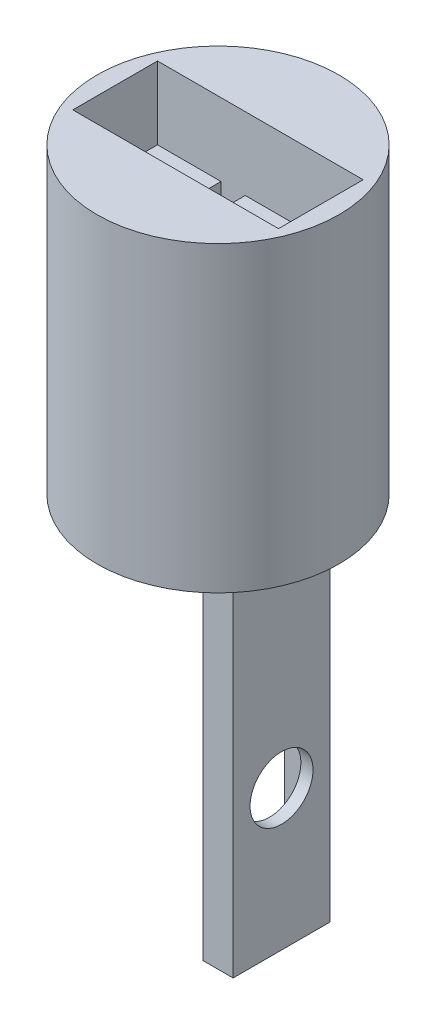
from build123d import *

# Parameters (mm, degrees)
SKETCH3_R           = 10
BOSS_EXTRUDE1_DEPTH = 25
SKETCH4_W           = 2.5
SKETCH4_H           = 8
BOSS_EXTRUDE2_DEPTH = 30
CUT_EXTRUDE1_REACH  = 37.108
SKETCH5_R           = 2.6
SKETCH6_W           = 5.5
SKETCH6_H           = 21.2
CUT_EXTRUDE2_DEPTH  = 1.5
SKETCH7_W           = 17
SKETCH7_H           = 7
CUT_EXTRUDE3_DEPTH  = 6
SKETCH8_W           = 2
SKETCH8_H           = 7
CUT_EXTRUDE4_DEPTH  = 4


with BuildPart() as part:
    # Sketch3 → Boss-Extrude1 (new body)
    with BuildSketch(Plane(origin=(0, 0, 0), x_dir=(1, 0, 0), z_dir=(0, 1, 0))):
        with Locations(Location((0, 0, 0), (0, 0, 270))):
            Circle(SKETCH3_R)
    extrude(amount=BOSS_EXTRUDE1_DEPTH)

    # Sketch4 → Boss-Extrude2 (add)
    with BuildSketch(Plane(origin=(0, 0, 0), x_dir=(-1, 0, 0), z_dir=(0, -1, 0))):
        with Locations((-4, 0)):
            Rectangle(SKETCH4_W, SKETCH4_H)
    extrude(amount=BOSS_EXTRUDE2_DEPTH)

    # Sketch5 → Cut-Extrude1 (cut, up to next)
    with BuildSketch(Plane(origin=(5.25, 0, 0), x_dir=(0, 0, -1), z_dir=(1, 0, 0)), mode=Mode.PRIVATE) as cut_extrude1_sk1:
        with Locations((0, -18.4)):
            Circle(SKETCH5_R)
    cut_extrude1_tool1 = extrude(cut_extrude1_sk1.sketch, amount=-CUT_EXTRUDE1_REACH, mode=Mode.PRIVATE) & part.part
    add(cut_extrude1_tool1.solids().sort_by_distance((5.25, -18.4, 0))[0], mode=Mode.SUBTRACT)

    # Sketch6 → Cut-Extrude2 (cut)
    with BuildSketch(Plane.ZY.offset(-2.75)):
        with Locations((0, -18.4)):
            Rectangle(SKETCH6_W, SKETCH6_H)
    extrude(amount=-CUT_EXTRUDE2_DEPTH, mode=Mode.SUBTRACT)

    # Sketch7 → Cut-Extrude3 (cut)
    with BuildSketch(Plane(origin=(0, 25, 0), x_dir=(1, 0, 0), z_dir=(0, 1, 0))):
        Rectangle(SKETCH7_W, SKETCH7_H)
    extrude(amount=-CUT_EXTRUDE3_DEPTH, mode=Mode.SUBTRACT)

    # Sketch8 → Cut-Extrude4 (cut)
    with BuildSketch(Plane(origin=(0, 19, 0), x_dir=(1, 0, 0), z_dir=(0, 1, 0))):
        with Locations((-2.25, 0)):
            Rectangle(SKETCH8_W, SKETCH8_H)
    extrude(amount=-CUT_EXTRUDE4_DEPTH, mode=Mode.SUBTRACT)


solid = part.part
